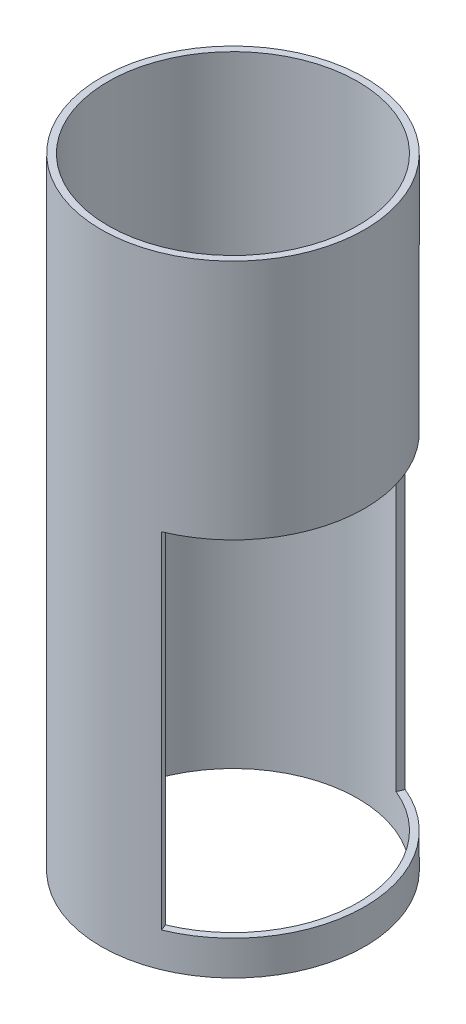
from build123d import *

# Parameters (mm, degrees)
SKETCH1_R           = 38.2
BOSS_EXTRUDE1_DEPTH = 180
SHELL1_T            = -2
CUT_EXTRUDE2_DEPTH  = 100


with BuildPart() as part:
    # Sketch1 → Boss-Extrude1 (new body)
    with BuildSketch(Plane(origin=(0, 0, 0), x_dir=(1, 0, 0), z_dir=(0, 1, 0))):
        with Locations(Location((0, 0, 0), (0, 0, 90))):
            Circle(SKETCH1_R)
    extrude(amount=BOSS_EXTRUDE1_DEPTH)

    # Shell1
    shell1_openings = [part.faces().sort_by_distance(p)[0] for p in [
        (0, 180, 0),
        (0, 0, 0),
    ]]
    offset(amount=SHELL1_T, openings=shell1_openings, kind=Kind.INTERSECTION)

    # Sketch4 → Cut-Extrude2 (cut)
    with BuildSketch(Plane(origin=(0, 10, 0), x_dir=(1, 0, 0), z_dir=(0, 1, 0))):
        with BuildLine():
            Line((0, 0), (14.618507116, 35.292198142))
            ThreePointArc((14.618507116, 35.292198142), (38.2, 0), (14.618507116, -35.292198142))
            Line((14.618507116, -35.292198142), (0, 0))
        make_face()
    extrude(amount=CUT_EXTRUDE2_DEPTH, mode=Mode.SUBTRACT)


solid = part.part
